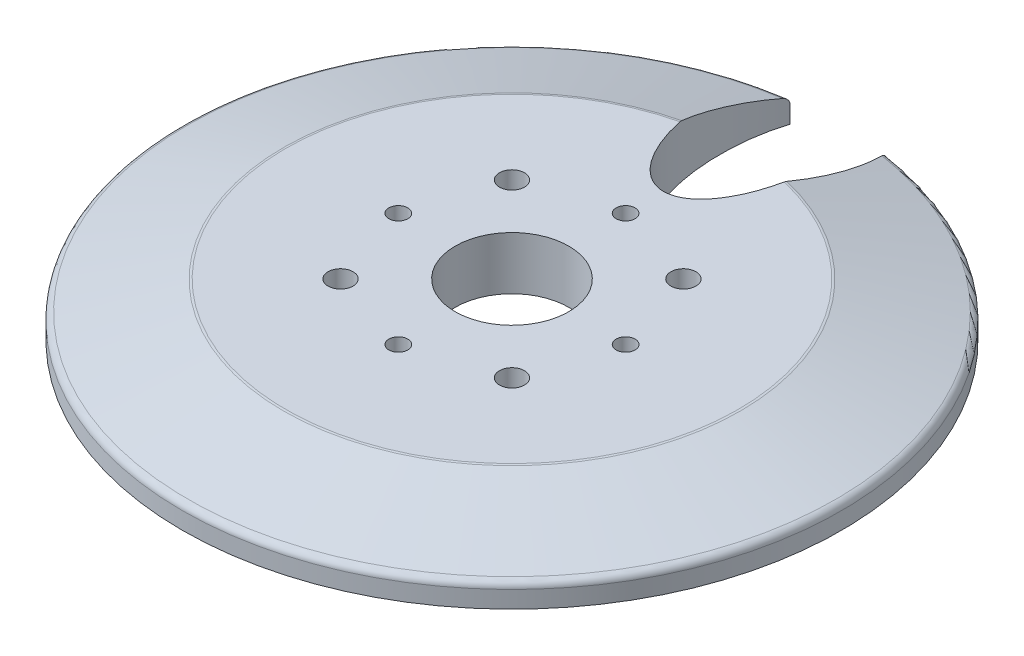
from build123d import *

# Parameters (mm, degrees)
SKETCH_2_R          = 7.5
CUT_EXTRUDE_1_DEPTH = 62.915264677
SKETCH_3_RX         = 15
SKETCH_3_RY         = 7.5
CUT_EXTRUDE_2_DEPTH = 62.915264677
M3X0_51_D           = 2.5
M4X0_71_D           = 3.3
FILLET_1_R          = 1


with BuildPart() as part:
    # Эскиз1 → Повернуть1 (revolve)
    with BuildSketch(Plane.XY):
        Polygon((0, 0), (-43.5, 0), (-43.5, 3), (-30, 7), (0, 7), align=None)
    revolve(axis=Axis((0, 7, 0), (0, -1, 0)))

    # Эскиз2 → Вырез-Вытянуть1 (cut, through all)
    with BuildSketch(Plane(origin=(0, 7, 0), x_dir=(1, 0, 0), z_dir=(0, 1, 0))):
        with Locations(Location((0, 0, 0), (0, 0, 180))):
            Circle(SKETCH_2_R)
    extrude(amount=-CUT_EXTRUDE_1_DEPTH, mode=Mode.SUBTRACT)

    # Эскиз3 → Вырез-Вытянуть2 (cut, through all)
    with BuildSketch(Plane(origin=(0, 7, 0), x_dir=(1, 0, 0), z_dir=(0, 1, 0))):
        with Locations(Location((0, 35), (0, 0, -90))):
            Ellipse(SKETCH_3_RX, SKETCH_3_RY)
    extrude(amount=-CUT_EXTRUDE_2_DEPTH, mode=Mode.SUBTRACT)

    # Отверстие обработанное метчиком M3x0.51 (through all)
    with Locations(Plane(origin=(0, 7, 0), x_dir=(1, 0, 0), z_dir=(0, 1, 0))):
        with Locations((0, 15), (-15, 0), (0, -15), (15, 0)):
            Hole(M3X0_51_D / 2)

    # Отверстие обработанное метчиком M4x0.71 (through all)
    with Locations(Plane(origin=(0, 7, 0), x_dir=(1, 0, 0), z_dir=(0, 1, 0))):
        with Locations((-11.313708499, 11.313708499), (11.313708499, 11.313708499), (11.313708499, -11.313708499), (-11.313708499, -11.313708499)):
            Hole(M4X0_71_D / 2)

    # Скругление1
    fillet_1_edges = [part.edges().sort_by_distance(p)[0] for p in [
        (0, 7, 30),
        (0, 3, 43.5),
    ]]
    fillet(fillet_1_edges, radius=FILLET_1_R)


solid = part.part
